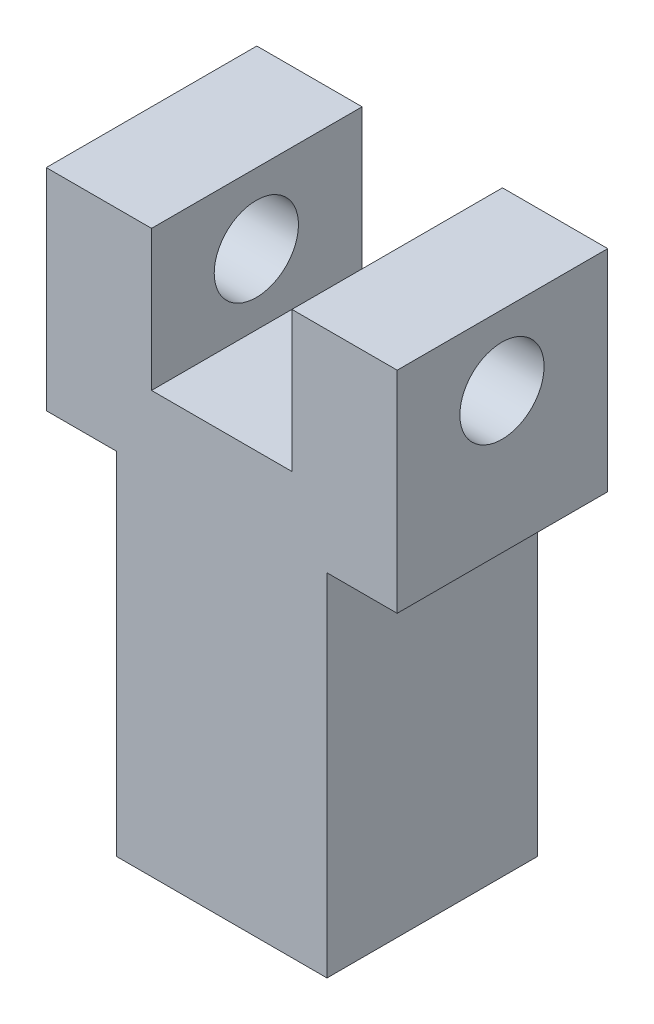
from build123d import *

# Parameters (mm, degrees)
BOSS_EXTRUDE1_DEPTH = 15
SKETCH2_R           = 3
CUT_EXTRUDE1_DEPTH  = 35
SKETCH3_W           = 15
SKETCH3_H           = 15
SKETCH3_W_2         = 10
SKETCH3_H_2         = 5
BOSS_EXTRUDE2_DEPTH = 25
SKETCH5_R           = 3
CUT_EXTRUDE3_DEPTH  = 7


with BuildPart() as part:
    # Sketch1 → Boss-Extrude1 (new body)
    with BuildSketch(Plane.XY):
        Polygon((3.687581296, 3.934802907), (3.687581296, -6.065197093), (-6.312418704, -6.065197093), (-6.312418704, 3.934802907), (-13.812418704, 3.934802907), (-13.812418704, -11.065197093), (11.187581296, -11.065197093), (11.187581296, 3.934802907), align=None)
    extrude(amount=BOSS_EXTRUDE1_DEPTH)

    # Sketch2 → Cut-Extrude1 (cut)
    with BuildSketch(Plane(origin=(11.187581296, 0, 0), x_dir=(0, 0, -1), z_dir=(1, 0, 0))):
        with Locations(Location((-7.534884308, -1.065197093, 0), (0, 0, 90))):
            Circle(SKETCH2_R)
    extrude(amount=-CUT_EXTRUDE1_DEPTH, mode=Mode.SUBTRACT)

    # Sketch3 → Boss-Extrude2 (add)
    with BuildSketch(Plane.XZ.offset(11.065197093)):
        with Locations((-1.312418704, 7.5)):
            Rectangle(SKETCH3_W, SKETCH3_H)
        with Locations((-1.312418704, 7.415567581)):
            Rectangle(SKETCH3_W_2, SKETCH3_H_2, mode=Mode.SUBTRACT)
    extrude(amount=BOSS_EXTRUDE2_DEPTH)

    # Sketch5 → Cut-Extrude3 (cut)
    with BuildSketch(Plane.ZY.offset(8.812418704)):
        with Locations((7.5, -23.565197093)):
            Circle(SKETCH5_R)
    extrude(amount=-CUT_EXTRUDE3_DEPTH, mode=Mode.SUBTRACT)


solid = part.part
